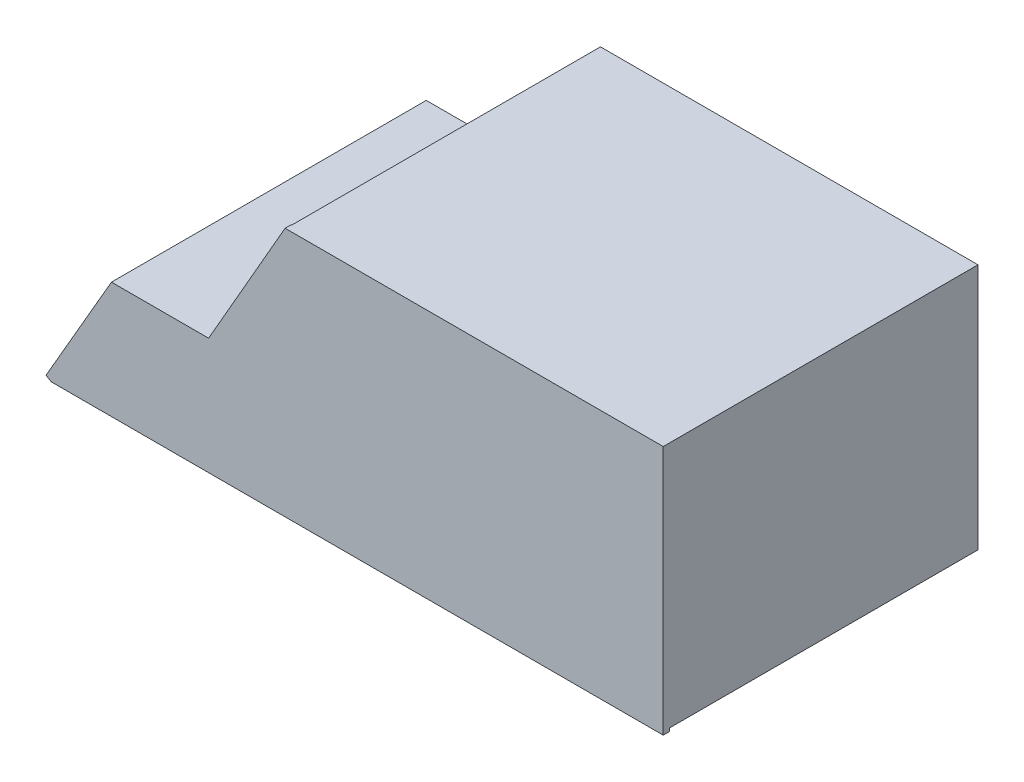
from build123d import *

# Parameters (mm, degrees)
EXTRU_MINCE1_DEPTH = 100
EXTRUSION2_DEPTH   = 2


with BuildPart() as part:
    # Esquisse1 → Extru.-Mince1 (new body)
    with BuildSketch(Plane.XY):
        Polygon((-49.585494923, -0.363286713), (-28.372291487, 36.379059428), (3.108706941, 36.379059428), (28.083525041, 79.636713287), (150.414505077, 79.636713287), (150.414505077, -0.363286713), (148.414505077, -0.363286713), (148.414505077, 77.636713287), (29.238225579, 77.636713287), (4.263407479, 34.379059428), (-27.217590949, 34.379059428), (-47.853444115, -1.363286713), align=None)
    extrude(amount=EXTRU_MINCE1_DEPTH)

    # Esquisse2 → Extrusion2 (add)
    with BuildSketch(Plane.XY.offset(100)):
        Polygon((27.911407902, -1.363286713), (-47.853444115, -1.363286713), (-49.585494923, -0.363286713), (-28.372291487, 36.379059428), (3.108706941, 36.379059428), (27.899141653, 79.636713287), (150.414505077, 79.636713287), (150.414505077, -1.363286713), align=None)
    extrude(amount=EXTRUSION2_DEPTH)


solid = part.part
